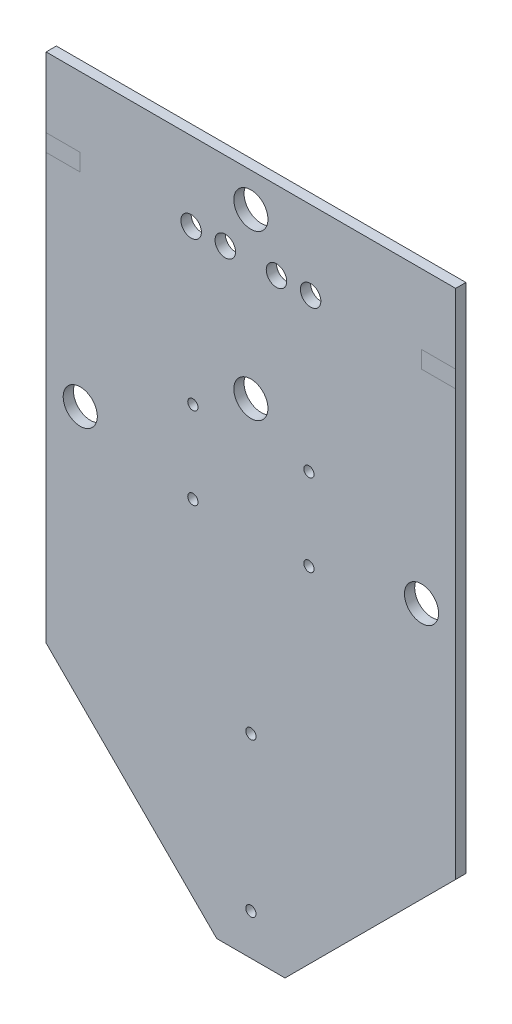
from build123d import *

# Parameters (mm, degrees)
EXTRUSION1_DEPTH        = 3
ESQUISSE4_R             = 5
ENL_V_MAT_EXTRU_3_DEPTH = 16
ESQUISSE8_R             = 3
ENL_V_MAT_EXTRU_5_DEPTH = 8
ESQUISSE9_R             = 1.5
ENL_V_MAT_EXTRU_6_DEPTH = 10
ESQUISSE11_W            = 10
ESQUISSE11_H            = 5
ENL_V_MAT_EXTRU_9_DEPTH = 0.0001
EXTRUSION2_DEPTH        = 2
ESQUISSE5_R             = 1.5
ENL_V_MAT_EXTRU_4_DEPTH = 25.792218749
ESQUISSE3_R             = 5
ENL_V_MAT_EXTRU_2_DEPTH = 16


with BuildPart() as part:
    # Esquisse1 → Extrusion1 (new body)
    with BuildSketch(Plane.XY):
        Polygon((0, 0), (-120, 0), (-120, -150), (-70, -200), (-50, -200), (0, -150), align=None)
    extrude(amount=EXTRUSION1_DEPTH)

    # Esquisse4 → Enlèv. mat.-Extru.3 (cut)
    with BuildSketch(Plane(origin=(0, 0, 0), x_dir=(-1, 0, 0), z_dir=(0, 0, -1))):
        with Locations((60, -10)):
            Circle(ESQUISSE4_R)
        with Locations((10, -85)):
            Circle(ESQUISSE4_R)
        with Locations((110, -85)):
            Circle(ESQUISSE4_R)
    extrude(amount=-ENL_V_MAT_EXTRU_3_DEPTH, mode=Mode.SUBTRACT)

    # Esquisse8 → Enlèv. mat.-Extru.5 (cut)
    with BuildSketch(Plane(origin=(0, 0, 0), x_dir=(-1, 0, 0), z_dir=(0, 0, -1))):
        with Locations((52.5, -23)):
            Circle(ESQUISSE8_R)
        with Locations((42.5, -23)):
            Circle(ESQUISSE8_R)
        with Locations((67.5, -23)):
            Circle(ESQUISSE8_R)
        with Locations((77.5, -23)):
            Circle(ESQUISSE8_R)
    extrude(amount=-ENL_V_MAT_EXTRU_5_DEPTH, mode=Mode.SUBTRACT)

    # Esquisse9 → Enlèv. mat.-Extru.6 (cut)
    with BuildSketch(Plane(origin=(0, 0, 0), x_dir=(-1, 0, 0), z_dir=(0, 0, -1))):
        with Locations((60, -143)):
            Circle(ESQUISSE9_R)
        with Locations((60, -188)):
            Circle(ESQUISSE9_R)
    extrude(amount=-ENL_V_MAT_EXTRU_6_DEPTH, mode=Mode.SUBTRACT)

    # Esquisse11 → Enlèv. mat.-Extru.9 (cut)
    with BuildSketch(Plane.XY.offset(3)):
        with Locations((-115, -23)):
            Rectangle(ESQUISSE11_W, ESQUISSE11_H)
        with Locations((-5, -23)):
            Rectangle(ESQUISSE11_W, ESQUISSE11_H)
    extrude(amount=-ENL_V_MAT_EXTRU_9_DEPTH, mode=Mode.SUBTRACT)

    # Esquisse12 → Extrusion2 (add)
    with BuildSketch(Plane(origin=(0, 0, 0), x_dir=(-1, 0, 0), z_dir=(0, 0, -1))):
        Polygon((30, -133.99467083), (30, -137), (31.859648796, -137), (31.859648796, -139), (28, -139), (28, -133.99467083), align=None)
    extrude(amount=EXTRUSION2_DEPTH)

    # Esquisse5 → Enlèv. mat.-Extru.4 (cut)
    with BuildSketch(Plane.XY):
        with Locations(Location((-77, -68, 0), (0, 0, 180))):
            Circle(ESQUISSE5_R)
        with Locations(Location((-43, -68, 0), (0, 0, 180))):
            Circle(ESQUISSE5_R)
        with Locations(Location((-43, -92, 0), (0, 0, 180))):
            Circle(ESQUISSE5_R)
        with Locations(Location((-77, -92, 0), (0, 0, 180))):
            Circle(ESQUISSE5_R)
    extrude(amount=ENL_V_MAT_EXTRU_4_DEPTH, mode=Mode.SUBTRACT)

    # Esquisse3 → Enlèv. mat.-Extru.2 (cut)
    with BuildSketch(Plane(origin=(0, 0, 0), x_dir=(-1, 0, 0), z_dir=(0, 0, -1))):
        with Locations((60, -58)):
            Circle(ESQUISSE3_R)
    extrude(amount=-ENL_V_MAT_EXTRU_2_DEPTH, mode=Mode.SUBTRACT)


solid = part.part
